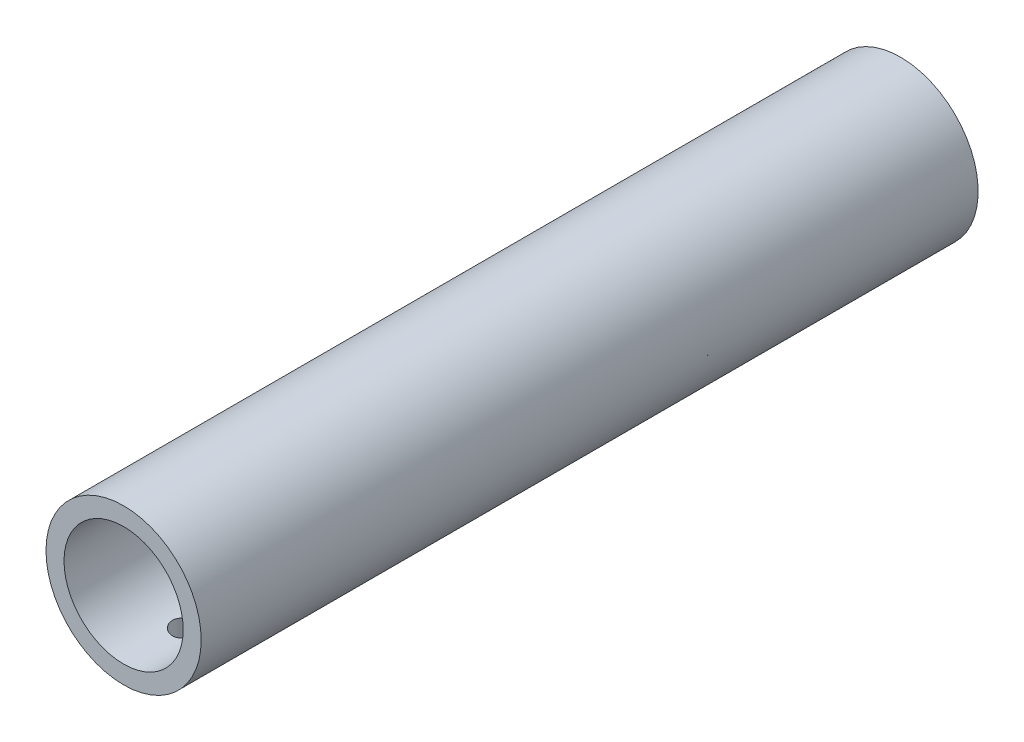
from build123d import *

# Parameters (mm, degrees)
SKETCH1_R           = 12.7
SKETCH1_R_2         = 9.75
BOSS_EXTRUDE1_DEPTH = 123
SKETCH7_R           = 1.5
SKETCH7_R_2         = 2
CUT_EXTRUDE1_DEPTH  = 108
BOSS_EXTRUDE2_START = 4.17
SKETCH8_R           = 12.7
SKETCH8_R_2         = 9.75
BOSS_EXTRUDE2_DEPTH = 4.17


with BuildPart() as part:
    # Sketch1 → Boss-Extrude1 (new body)
    with BuildSketch(Plane.XY):
        Circle(SKETCH1_R)
        Circle(SKETCH1_R_2, mode=Mode.SUBTRACT)
    extrude(amount=BOSS_EXTRUDE1_DEPTH)

    # Sketch7 → Cut-Extrude1 (cut)
    with BuildSketch(Plane(origin=(0, 0, 0), x_dir=(1, 0, 0), z_dir=(0, 1, 0))):
        with Locations(Location((0, -10.17, 0), (0, 0, 270))):
            Circle(SKETCH7_R)
        with Locations(Location((0, -29, 0), (0, 0, 270))):
            Circle(SKETCH7_R)
        with Locations(Location((0, -113, 0), (0, 0, 270))):
            Circle(SKETCH7_R_2)
    extrude(amount=-CUT_EXTRUDE1_DEPTH, mode=Mode.SUBTRACT)

    # Sketch8 → Boss-Extrude2 (add)
    with BuildSketch(Plane(origin=(0, 0, 0), x_dir=(-1, 0, 0), z_dir=(0, 0, -1)).offset(BOSS_EXTRUDE2_START)):
        Circle(SKETCH8_R)
        Circle(SKETCH8_R_2, mode=Mode.SUBTRACT)
    extrude(amount=-BOSS_EXTRUDE2_DEPTH)


solid = part.part
